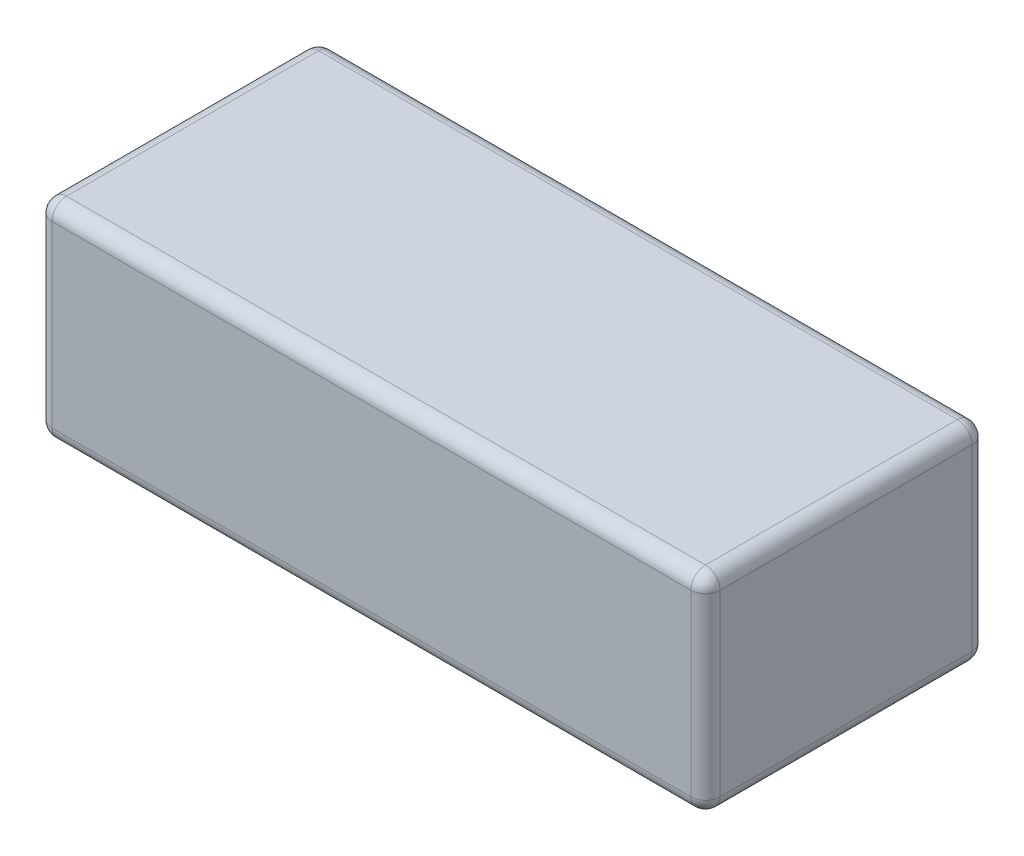
from build123d import *

# Parameters (mm, degrees)
SKETCH1_W           = 183
SKETCH1_H           = 77
BOSS_EXTRUDE1_DEPTH = 57
FILLET1_R           = 4
SKETCH2_R           = 19.259927961
CUT_EXTRUDE1_DEPTH  = 42


with BuildPart() as part:
    # Sketch1 → Boss-Extrude1 (new body)
    with BuildSketch(Plane(origin=(0, 0, 0), x_dir=(1, 0, 0), z_dir=(0, 1, 0))):
        with Locations((-105.718045113, 24.105263158)):
            Rectangle(SKETCH1_W, SKETCH1_H)
    extrude(amount=BOSS_EXTRUDE1_DEPTH)

    # Fillet1
    fillet1_edges = [part.edges().sort_by_distance(p)[0] for p in [
        (-14.218045113, 57, -24.105263158),
        (-105.718045113, 57, -62.605263158),
        (-197.218045113, 57, -24.105263158),
        (-105.718045113, 0, -62.605263158),
        (-14.218045113, 0, -24.105263158),
        (-105.718045113, 0, 14.394736842),
        (-197.218045113, 0, -24.105263158),
        (-105.718045113, 57, 14.394736842),
        (-197.218045113, 28.5, -62.605263158),
        (-14.218045113, 28.5, -62.605263158),
        (-14.218045113, 28.5, 14.394736842),
        (-197.218045113, 28.5, 14.394736842),
    ]]
    fillet(fillet1_edges, radius=FILLET1_R)

    # Sketch2 → Cut-Extrude1 (cut, symmetric)
    with BuildSketch(Plane(origin=(-105.718045113, 0, 0), x_dir=(0, 0, -1), z_dir=(1, 0, 0))):
        with Locations(Location((25.391658687, 29.2539915, 0), (0, 0, 180))):
            Circle(SKETCH2_R)
    extrude(amount=CUT_EXTRUDE1_DEPTH, both=True, mode=Mode.SUBTRACT)


solid = part.part
